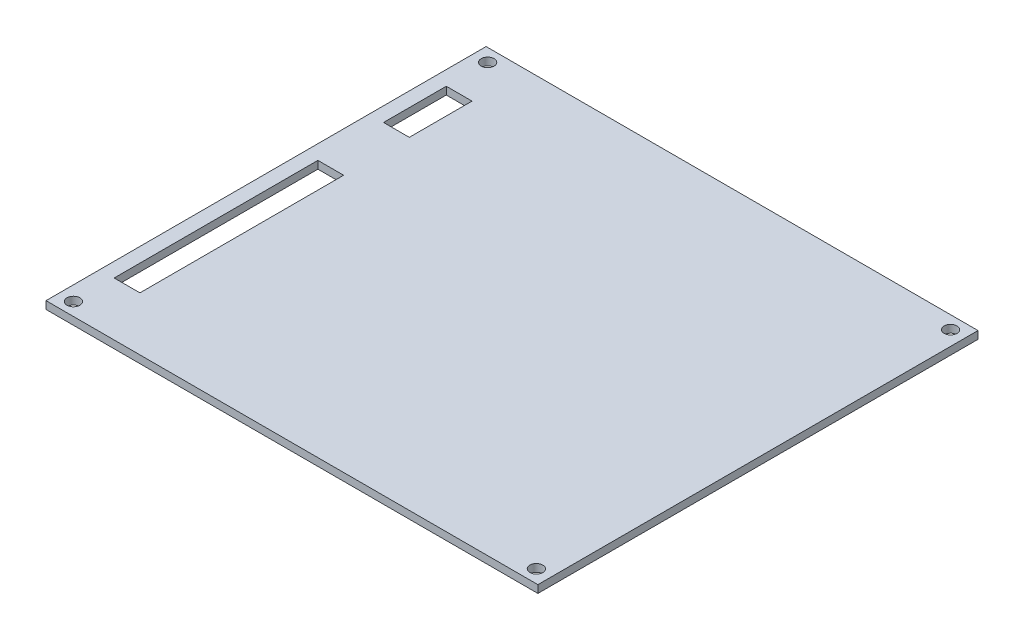
from build123d import *

# Parameters (mm, degrees)
SKETCH1_W           = 96.52
SKETCH1_H           = 86.36
SKETCH1_R           = 1.27
SKETCH1_W_2         = 5.052423249
SKETCH1_H_2         = 12.313816371
SKETCH1_H_3         = 39.972542374
BOSS_EXTRUDE1_DEPTH = 1.5


with BuildPart() as part:
    # Sketch1 → Boss-Extrude1 (new body)
    with BuildSketch(Plane(origin=(0, 0, 0), x_dir=(1, 0, 0), z_dir=(0, 1, 0))):
        Rectangle(SKETCH1_W, SKETCH1_H)
        with Locations(Location((-45.421176471, 40.64, 0), (0, 0, 270))):
            Circle(SKETCH1_R, mode=Mode.SUBTRACT)
        with Locations(Location((45.421176471, 40.64, 0), (0, 0, 270))):
            Circle(SKETCH1_R, mode=Mode.SUBTRACT)
        with Locations(Location((-45.421176471, -40.64, 0), (0, 0, 270))):
            Circle(SKETCH1_R, mode=Mode.SUBTRACT)
        with Locations(Location((45.421176471, -40.64, 0), (0, 0, 270))):
            Circle(SKETCH1_R, mode=Mode.SUBTRACT)
        with Locations((-42.894964847, 26.371121385)):
            Rectangle(SKETCH1_W_2, SKETCH1_H_2, mode=Mode.SUBTRACT)
        with Locations((-42.894964847, -12.654204345)):
            Rectangle(SKETCH1_W_2, SKETCH1_H_3, mode=Mode.SUBTRACT)
    extrude(amount=BOSS_EXTRUDE1_DEPTH)


solid = part.part
